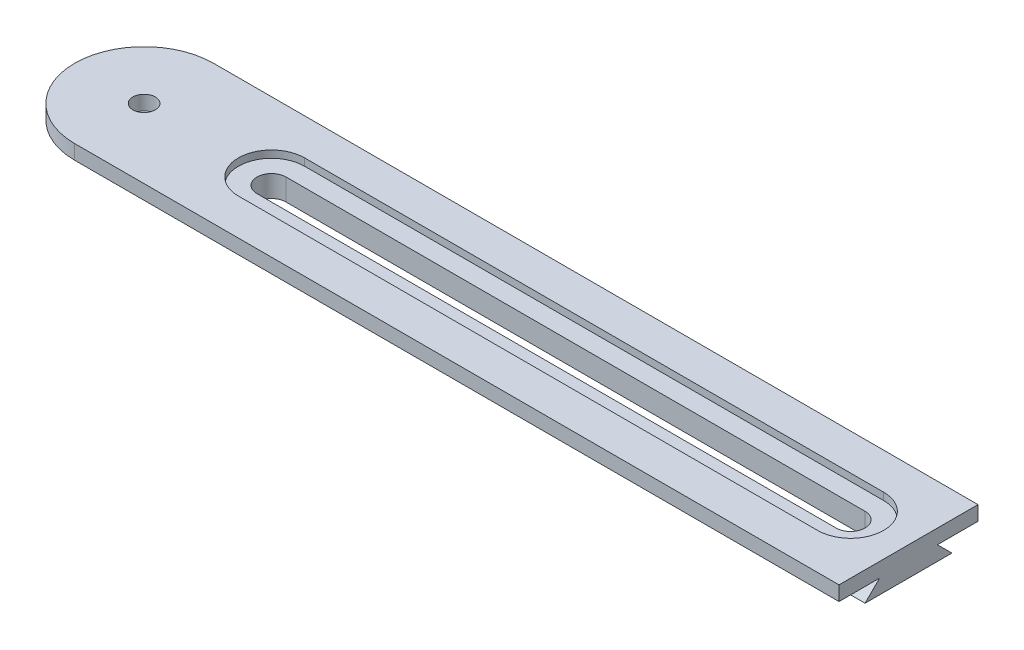
from build123d import *

# Parameters (mm, degrees)
SKETCH1_W             = 152.4
SKETCH1_H             = 30.48
BOSS_EXTRUDE1_DEPTH   = 6.35
CUT_EXTRUDE1_DEPTH    = 156.547783334
CUT_EXTRUDE2_DEPTH    = 1.5875
CUT_EXTRUDE3_DEPTH    = 156.547783334
BOSS_EXTRUDE2_DEPTH   = 3.175
F_8_CLEARANCE_HOLE1_D = 4.9149


with BuildPart() as part:
    # Sketch1 → Boss-Extrude1 (new body)
    with BuildSketch(Plane(origin=(0, 0, 0), x_dir=(1, 0, 0), z_dir=(0, 1, 0))):
        with Locations((76.2, 15.24)):
            Rectangle(SKETCH1_W, SKETCH1_H)
    extrude(amount=BOSS_EXTRUDE1_DEPTH)

    # Sketch2 → Cut-Extrude1 (cut, through all)
    with BuildSketch(Plane(origin=(0, 6.35, 0), x_dir=(1, 0, 0), z_dir=(0, 1, 0))):
        with BuildLine():
            Line((12.7, 18.415), (139.7, 18.415))
            ThreePointArc((139.7, 18.415), (142.875, 15.24), (139.7, 12.065))
            Line((139.7, 12.065), (12.7, 12.065))
            ThreePointArc((12.7, 12.065), (9.525, 15.24), (12.7, 18.415))
        make_face()
    extrude(amount=-CUT_EXTRUDE1_DEPTH, mode=Mode.SUBTRACT)

    # Sketch3 → Cut-Extrude2 (cut)
    with BuildSketch(Plane(origin=(0, 6.35, 0), x_dir=(1, 0, 0), z_dir=(0, 1, 0))):
        with BuildLine():
            Line((12.7, 22.493732), (139.7, 22.493732))
            ThreePointArc((139.7, 22.493732), (146.953732, 15.24), (139.7, 7.986268))
            Line((139.7, 7.986268), (12.7, 7.986268))
            ThreePointArc((12.7, 7.986268), (5.446268, 15.24), (12.7, 22.493732))
        make_face()
    extrude(amount=-CUT_EXTRUDE2_DEPTH, mode=Mode.SUBTRACT)

    # Sketch4 → Cut-Extrude3 (cut, through all)
    with BuildSketch(Plane.ZY):
        Polygon((-8.89, 3.175), (-5.715, 0), (0, 0), (0, 3.175), align=None)
    cut_extrude3 = extrude(amount=-CUT_EXTRUDE3_DEPTH, mode=Mode.SUBTRACT)

    # Mirror1: Cut-Extrude3 across plane
    add(cut_extrude3.mirror(Plane(origin=(0, 0, -15.24), x_dir=(1, 0, 0), z_dir=(0, 0, -1))), mode=Mode.SUBTRACT)

    # Sketch8 → Boss-Extrude2 (add)
    with BuildSketch(Plane(origin=(0, 6.35, 0), x_dir=(1, 0, 0), z_dir=(0, 1, 0))):
        with BuildLine():
            Line((0, 0), (-15.24, 0))
            ThreePointArc((-15.24, 0), (-30.48, 15.24), (-15.24, 30.48))
            Line((-15.24, 30.48), (0, 30.48))
            Line((0, 30.48), (0, 0))
        make_face()
    extrude(amount=-BOSS_EXTRUDE2_DEPTH)

    # #8 Clearance Hole1 (through all)
    with Locations(Plane(origin=(0, 6.35, 0), x_dir=(1, 0, 0), z_dir=(0, 1, 0))):
        with Locations((-15.24, 15.24)):
            Hole(F_8_CLEARANCE_HOLE1_D / 2)


solid = part.part
